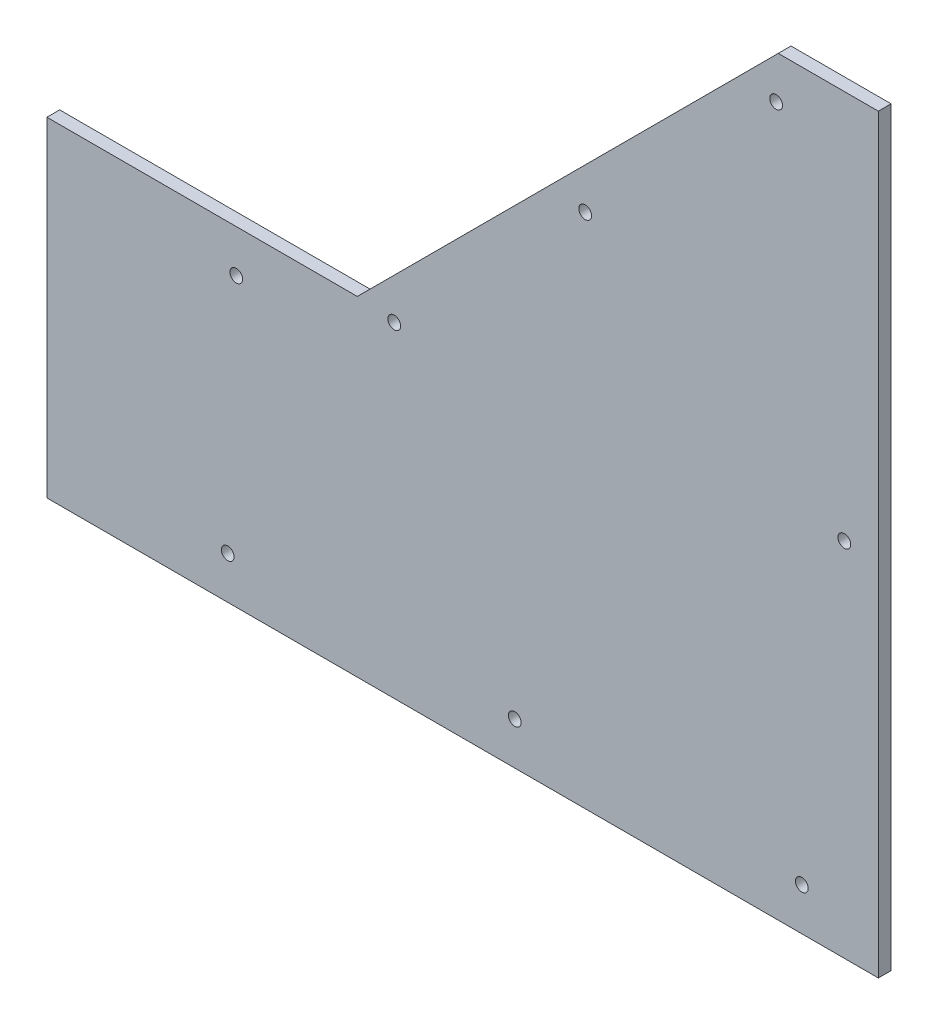
from build123d import *

# Parameters (mm, degrees)
BOSS_EXTRUDE1_DEPTH = 3
CUT_EXTRUDE1_REACH  = 265.453
SKETCH2_R           = 1.5
LPATTERN2_COUNT     = 3
LPATTERN2_PITCH     = 63.5
CUT_EXTRUDE2_REACH  = 265.453
SKETCH3_R           = 1.5
CUT_EXTRUDE3_REACH  = 265.453
SKETCH4_R           = 1.5
CUT_EXTRUDE4_REACH  = 265.453
SKETCH5_R           = 1.5


with BuildPart() as part:
    # Sketch1 → Boss-Extrude1 (new body)
    with BuildSketch(Plane.XY):
        Polygon((0, 0), (-195.53, 0), (-195.53, 77.54), (-122.53, 77.54), (-23.54, 176.54), (0, 176.54), align=None)
    extrude(amount=BOSS_EXTRUDE1_DEPTH)

    # Sketch2 → Cut-Extrude1 (cut, up to next)
    with BuildSketch(Plane.XY.offset(3), mode=Mode.PRIVATE) as cut_extrude1_sk1:
        with Locations((-24.04, 166.4)):
            Circle(SKETCH2_R)
    cut_extrude1_tool1 = extrude(cut_extrude1_sk1.sketch, amount=-CUT_EXTRUDE1_REACH, mode=Mode.PRIVATE) & part.part
    cut_extrude1 = cut_extrude1_tool1.solids().sort_by_distance((-24.04, 166.4, 3))[0]
    add(cut_extrude1, mode=Mode.SUBTRACT)

    # LPattern2: Cut-Extrude1 ×3
    with Locations(*[Vector(-0.707071066017225, -0.707142494552028, 0) * (i * LPATTERN2_PITCH) for i in range(1, LPATTERN2_COUNT)]):
        add(cut_extrude1, mode=Mode.SUBTRACT)

    # Sketch3 → Cut-Extrude2 (cut, up to next)
    with BuildSketch(Plane.XY.offset(3), mode=Mode.PRIVATE) as cut_extrude2_sk1:
        with Locations((-18, 10)):
            Circle(SKETCH3_R)
    cut_extrude2_tool1 = extrude(cut_extrude2_sk1.sketch, amount=-CUT_EXTRUDE2_REACH, mode=Mode.PRIVATE) & part.part
    # Sketch3 → Cut-Extrude2 (cut, up to next)
    with BuildSketch(Plane.XY.offset(3), mode=Mode.PRIVATE) as cut_extrude2_sk2:
        with Locations((-85.5, 10)):
            Circle(SKETCH3_R)
    cut_extrude2_tool2 = extrude(cut_extrude2_sk2.sketch, amount=-CUT_EXTRUDE2_REACH, mode=Mode.PRIVATE) & part.part
    # Sketch3 → Cut-Extrude2 (cut, up to next)
    with BuildSketch(Plane.XY.offset(3), mode=Mode.PRIVATE) as cut_extrude2_sk3:
        with Locations((-153, 10)):
            Circle(SKETCH3_R)
    cut_extrude2_tool3 = extrude(cut_extrude2_sk3.sketch, amount=-CUT_EXTRUDE2_REACH, mode=Mode.PRIVATE) & part.part
    add(cut_extrude2_tool1.solids().sort_by_distance((-18, 10, 3))[0], mode=Mode.SUBTRACT)
    add(cut_extrude2_tool2.solids().sort_by_distance((-85.5, 10, 3))[0], mode=Mode.SUBTRACT)
    add(cut_extrude2_tool3.solids().sort_by_distance((-153, 10, 3))[0], mode=Mode.SUBTRACT)

    # Sketch4 → Cut-Extrude3 (cut, up to next)
    with BuildSketch(Plane.XY.offset(3), mode=Mode.PRIVATE) as cut_extrude3_sk1:
        with Locations((-150.995, 67.54)):
            Circle(SKETCH4_R)
    cut_extrude3_tool1 = extrude(cut_extrude3_sk1.sketch, amount=-CUT_EXTRUDE3_REACH, mode=Mode.PRIVATE) & part.part
    add(cut_extrude3_tool1.solids().sort_by_distance((-150.995, 67.54, 3))[0], mode=Mode.SUBTRACT)

    # Sketch5 → Cut-Extrude4 (cut, up to next)
    with BuildSketch(Plane.XY.offset(3), mode=Mode.PRIVATE) as cut_extrude4_sk1:
        with Locations((-8, 85.01)):
            Circle(SKETCH5_R)
    cut_extrude4_tool1 = extrude(cut_extrude4_sk1.sketch, amount=-CUT_EXTRUDE4_REACH, mode=Mode.PRIVATE) & part.part
    add(cut_extrude4_tool1.solids().sort_by_distance((-8, 85.01, 3))[0], mode=Mode.SUBTRACT)


solid = part.part
